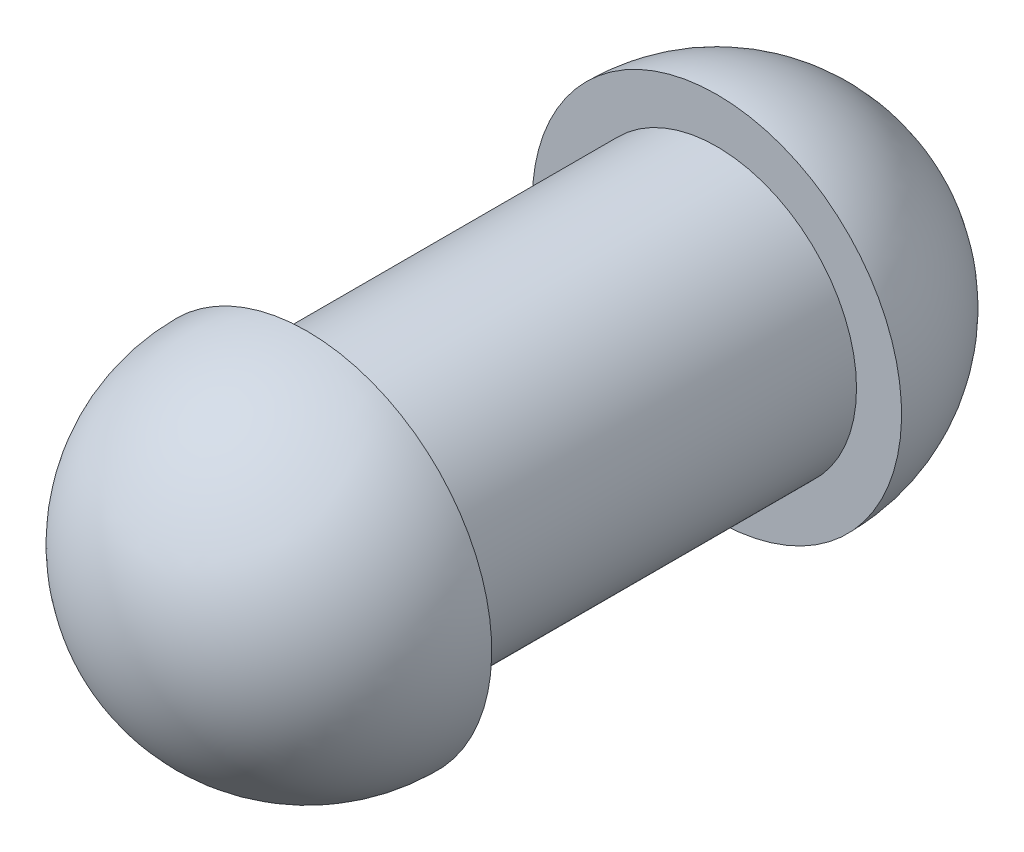
from build123d import *

# Parameters (mm, degrees)
SKETCH1_R           = 15.5
BOSS_EXTRUDE1_DEPTH = 22.75


with BuildPart() as part:
    # Sketch1 → Boss-Extrude1 (new, symmetric)
    with BuildSketch(Plane.XY):
        Circle(SKETCH1_R)
    extrude(amount=BOSS_EXTRUDE1_DEPTH, both=True)

    # Sketch2 → Revolve1 (revolve)
    with BuildSketch(Plane(origin=(0, 0, 0), x_dir=(0, 0, -1), z_dir=(1, 0, 0))):
        with BuildLine():
            Line((-43.25, 0), (-22.75, 0))
            Line((-22.75, 0), (-22.75, 20.5))
            ThreePointArc((-22.75, 20.5), (-37.245689014, 14.495689014), (-43.25, 0))
        make_face()
    revolve(axis=Axis((0, 0, 0), (0, 0, 1)))

    # Mirror1: part across plane


with BuildPart() as part_1:
    add(part.part)
    add(part.part.mirror(Plane.XY))


solid = part_1.part
